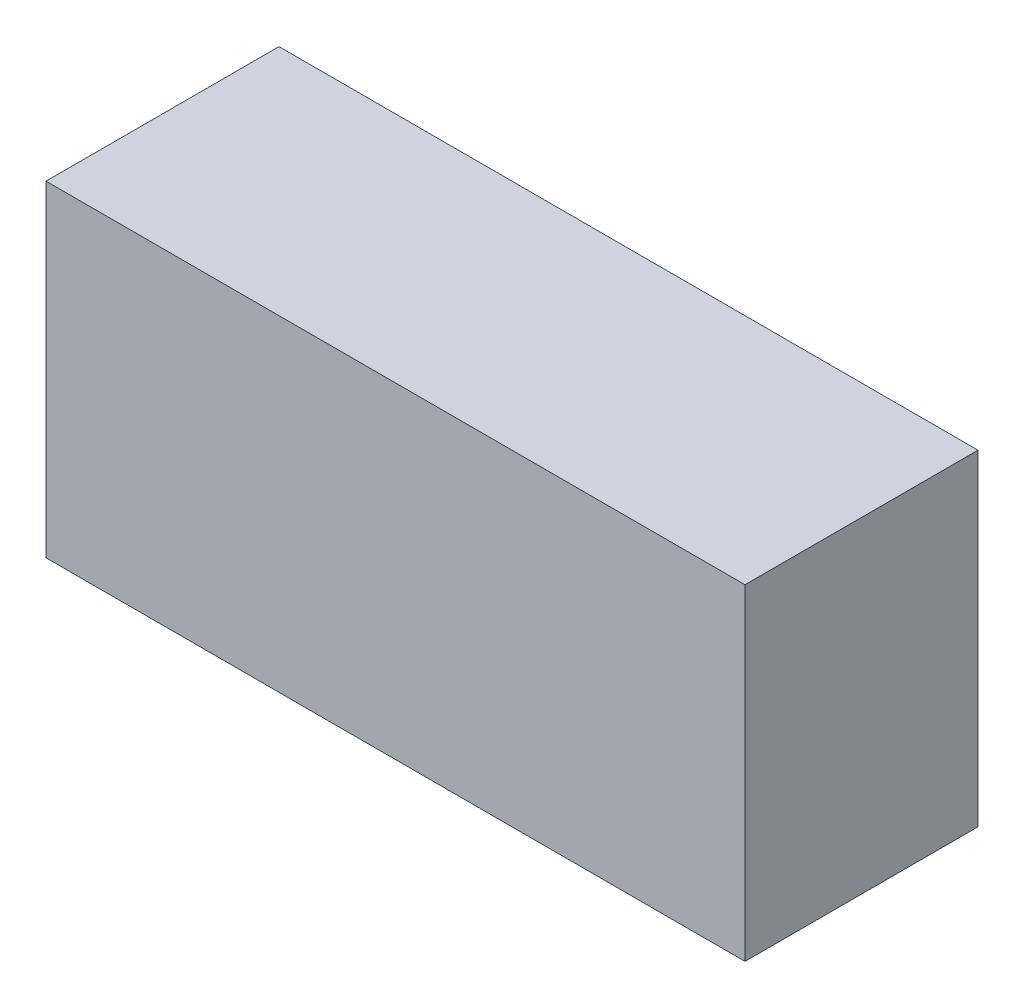
from build123d import *

# Parameters (mm, degrees)
SKETCH1_W           = 75
SKETCH1_H           = 25
BOSS_EXTRUDE1_DEPTH = 35


with BuildPart() as part:
    # Sketch1 → Boss-Extrude1 (new body)
    with BuildSketch(Plane(origin=(0, 3, 0), x_dir=(1, 0, 0), z_dir=(0, 1, 0))):
        with Locations((0, -25)):
            Rectangle(SKETCH1_W, SKETCH1_H)
    extrude(amount=BOSS_EXTRUDE1_DEPTH)


solid = part.part
